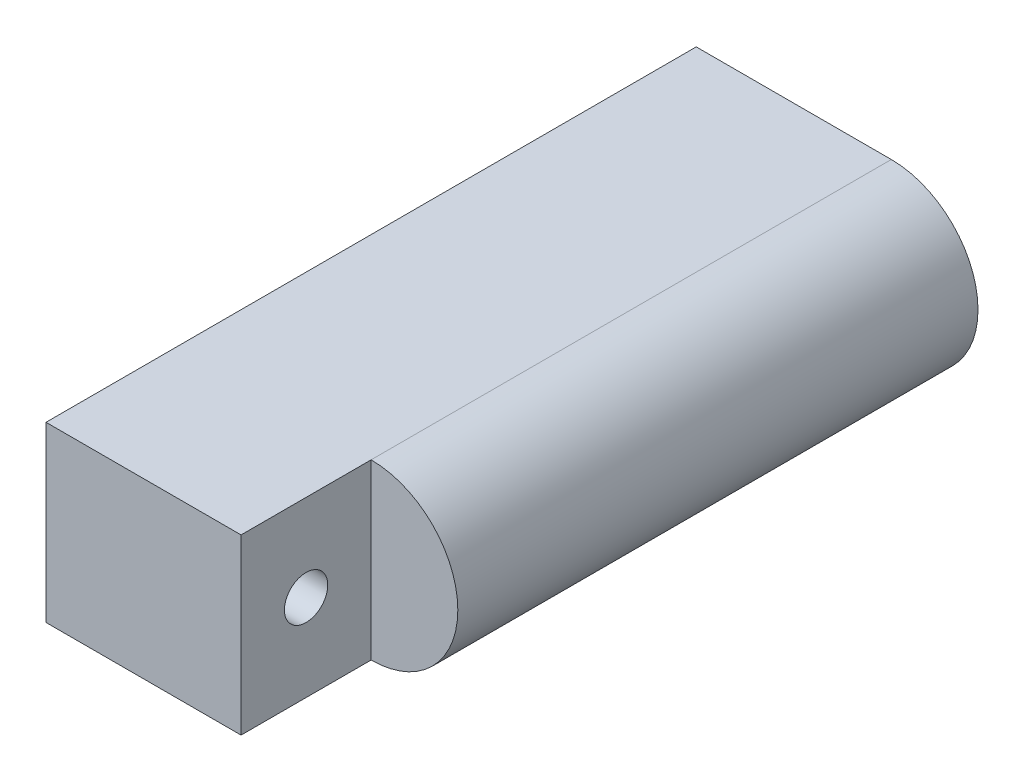
from build123d import *

# Parameters (mm, degrees)
SALIENTE_EXTRUIR1_DEPTH = 150
CROQUIS4_W              = 20
CROQUIS4_H              = 40
CORTAR_EXTRUIR1_DEPTH   = 30
CROQUIS5_R              = 5
CORTAR_EXTRUIR2_DEPTH   = 52


with BuildPart() as part:
    # Croquis1 → Saliente-Extruir1 (new body)
    with BuildSketch(Plane.XY):
        with BuildLine():
            Line((-22.5, -20), (22.5, -20))
            ThreePointArc((22.5, -20), (42.5, 0), (22.5, 20))
            Line((22.5, 20), (-22.5, 20))
            Line((-22.5, 20), (-22.5, -20))
        make_face()
    extrude(amount=SALIENTE_EXTRUIR1_DEPTH)

    # Croquis4 → Cortar-Extruir1 (cut)
    with BuildSketch(Plane.XY.offset(150)):
        with Locations((32.5, 0)):
            Rectangle(CROQUIS4_W, CROQUIS4_H)
    extrude(amount=-CORTAR_EXTRUIR1_DEPTH, mode=Mode.SUBTRACT)

    # Croquis5 → Cortar-Extruir2 (cut)
    with BuildSketch(Plane.ZY.offset(22.5)):
        with Locations((135, 0)):
            Circle(CROQUIS5_R)
    extrude(amount=-CORTAR_EXTRUIR2_DEPTH, mode=Mode.SUBTRACT)


solid = part.part
